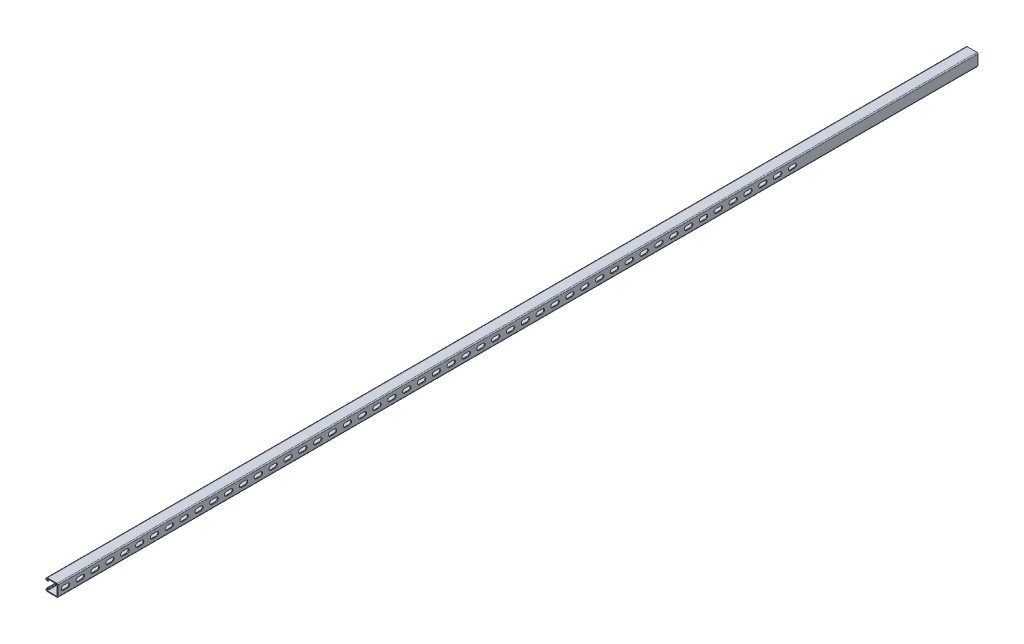
from build123d import *

# Parameters (mm, degrees)
BOSS_EXTRUDE1_DEPTH = 2540
CUT_EXTRUDE1_DEPTH  = 2.794
LPATTERN1_COUNT     = 50
LPATTERN1_PITCH     = 50.8
BOSS_EXTRUDE2_DEPTH = 609.6


with BuildPart() as part:
    # Sketch1 → Boss-Extrude1 (new body)
    with BuildSketch(Plane.XY):
        with BuildLine():
            Line((-36.22675, 20.6375), (-3.46075, 20.6375))
            ThreePointArc((-3.46075, 20.6375), (-1.013630207, 19.623869793), (0, 17.17675))
            Line((0, 17.17675), (0, -17.17675))
            ThreePointArc((0, -17.17675), (-1.013630207, -19.623869793), (-3.46075, -20.6375))
            Line((-3.46075, -20.6375), (-36.22675, -20.6375))
            ThreePointArc((-36.22675, -20.6375), (-39.796401808, -19.158901808), (-41.275, -15.58925))
            Line((-41.275, -15.58925), (-41.275, -14.57325))
            ThreePointArc((-41.275, -14.57325), (-40.261369793, -12.126130207), (-37.81425, -11.1125))
            Line((-37.81425, -11.1125), (-35.5346, -11.1125))
            ThreePointArc((-35.5346, -11.1125), (-34.1376, -12.5095), (-35.5346, -13.9065))
            Line((-35.5346, -13.9065), (-37.81425, -13.9065))
            ThreePointArc((-37.81425, -13.9065), (-38.285713446, -14.101786554), (-38.481, -14.57325))
            Line((-38.481, -14.57325), (-38.481, -15.58925))
            ThreePointArc((-38.481, -15.58925), (-37.820745461, -17.183245461), (-36.22675, -17.8435))
            Line((-36.22675, -17.8435), (-3.46075, -17.8435))
            ThreePointArc((-3.46075, -17.8435), (-2.989286554, -17.648213446), (-2.794, -17.17675))
            Line((-2.794, -17.17675), (-2.794, 17.17675))
            ThreePointArc((-2.794, 17.17675), (-2.989286554, 17.648213446), (-3.46075, 17.8435))
            Line((-3.46075, 17.8435), (-36.22675, 17.8435))
            ThreePointArc((-36.22675, 17.8435), (-37.820745461, 17.183245461), (-38.481, 15.58925))
            Line((-38.481, 15.58925), (-38.481, 14.57325))
            ThreePointArc((-38.481, 14.57325), (-38.285713446, 14.101786554), (-37.81425, 13.9065))
            Line((-37.81425, 13.9065), (-35.5346, 13.9065))
            ThreePointArc((-35.5346, 13.9065), (-34.1376, 12.5095), (-35.5346, 11.1125))
            Line((-35.5346, 11.1125), (-37.81425, 11.1125))
            ThreePointArc((-37.81425, 11.1125), (-40.261369793, 12.126130207), (-41.275, 14.57325))
            Line((-41.275, 14.57325), (-41.275, 15.58925))
            ThreePointArc((-41.275, 15.58925), (-39.796401808, 19.158901808), (-36.22675, 20.6375))
        make_face()
    extrude(amount=-BOSS_EXTRUDE1_DEPTH)

    # Sketch2 → Cut-Extrude1 (cut)
    with BuildSketch(Plane(origin=(0, 0, 0), x_dir=(0, 0, -1), z_dir=(1, 0, 0))):
        with BuildLine():
            Line((18.25625, 7.14375), (32.54375, 7.14375))
            ThreePointArc((32.54375, 7.14375), (39.6875, 0), (32.54375, -7.14375))
            Line((32.54375, -7.14375), (18.25625, -7.14375))
            ThreePointArc((18.25625, -7.14375), (11.1125, 0), (18.25625, 7.14375))
        make_face()
    cut_extrude1 = extrude(amount=-CUT_EXTRUDE1_DEPTH, mode=Mode.SUBTRACT)

    # LPattern1: Cut-Extrude1 ×50
    with Locations(*[(0, 0, -i * LPATTERN1_PITCH) for i in range(1, LPATTERN1_COUNT)]):
        add(cut_extrude1, mode=Mode.SUBTRACT)

    # Sketch4 → Boss-Extrude2 (add)
    with BuildSketch(Plane(origin=(0, 0, -2540), x_dir=(-1, 0, 0), z_dir=(0, 0, -1))):
        with BuildLine():
            Line((36.22675, 20.6375), (3.46075, 20.6375))
            ThreePointArc((3.46075, 20.6375), (1.013630207, 19.623869793), (0, 17.17675))
            Line((0, 17.17675), (0, -17.17675))
            ThreePointArc((0, -17.17675), (1.013630207, -19.623869793), (3.46075, -20.6375))
            Line((3.46075, -20.6375), (36.22675, -20.6375))
            ThreePointArc((36.22675, -20.6375), (39.796401808, -19.158901808), (41.275, -15.58925))
            Line((41.275, -15.58925), (41.275, -14.57325))
            ThreePointArc((41.275, -14.57325), (40.261369793, -12.126130207), (37.81425, -11.1125))
            Line((37.81425, -11.1125), (35.5346, -11.1125))
            ThreePointArc((35.5346, -11.1125), (34.1376, -12.5095), (35.5346, -13.9065))
            Line((35.5346, -13.9065), (37.81425, -13.9065))
            ThreePointArc((37.81425, -13.9065), (38.285713446, -14.101786554), (38.481, -14.57325))
            Line((38.481, -14.57325), (38.481, -15.58925))
            ThreePointArc((38.481, -15.58925), (37.820745461, -17.183245461), (36.22675, -17.8435))
            Line((36.22675, -17.8435), (3.46075, -17.8435))
            ThreePointArc((3.46075, -17.8435), (2.989286554, -17.648213446), (2.794, -17.17675))
            Line((2.794, -17.17675), (2.794, 17.17675))
            ThreePointArc((2.794, 17.17675), (2.989286554, 17.648213446), (3.46075, 17.8435))
            Line((3.46075, 17.8435), (36.22675, 17.8435))
            ThreePointArc((36.22675, 17.8435), (37.820745461, 17.183245461), (38.481, 15.58925))
            Line((38.481, 15.58925), (38.481, 14.57325))
            ThreePointArc((38.481, 14.57325), (38.285713446, 14.101786554), (37.81425, 13.9065))
            Line((37.81425, 13.9065), (35.5346, 13.9065))
            ThreePointArc((35.5346, 13.9065), (34.1376, 12.5095), (35.5346, 11.1125))
            Line((35.5346, 11.1125), (37.81425, 11.1125))
            ThreePointArc((37.81425, 11.1125), (40.261369793, 12.126130207), (41.275, 14.57325))
            Line((41.275, 14.57325), (41.275, 15.58925))
            ThreePointArc((41.275, 15.58925), (39.796401808, 19.158901808), (36.22675, 20.6375))
        make_face()
    extrude(amount=BOSS_EXTRUDE2_DEPTH)


solid = part.part
